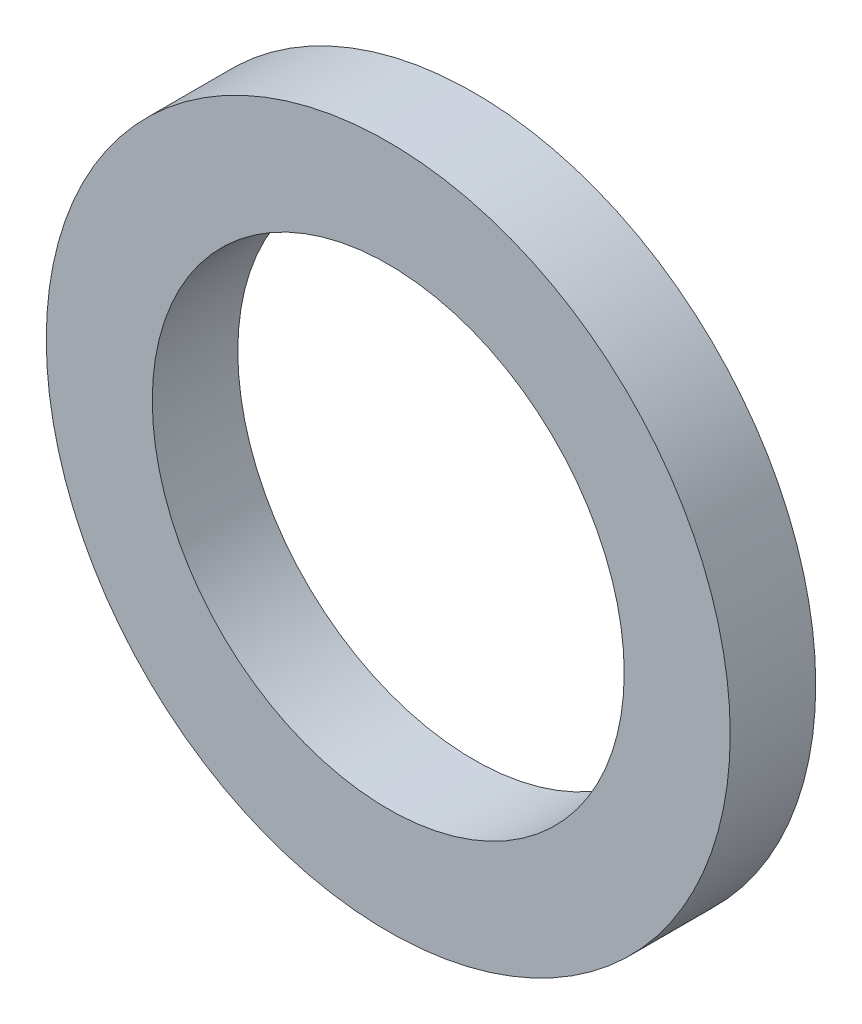
from build123d import *

# Parameters (mm, degrees)
SKETCH1_R           = 12.7
BOSS_EXTRUDE1_DEPTH = 3.175
SKETCH2_R           = 8.763
CUT_EXTRUDE1_DEPTH  = 3.175


with BuildPart() as part:
    # Sketch1 → Boss-Extrude1 (new body)
    with BuildSketch(Plane.XY):
        Circle(SKETCH1_R)
    extrude(amount=BOSS_EXTRUDE1_DEPTH)

    # Sketch2 → Cut-Extrude1 (cut)
    with BuildSketch(Plane.XY.offset(3.175)):
        Circle(SKETCH2_R)
    extrude(amount=-CUT_EXTRUDE1_DEPTH, mode=Mode.SUBTRACT)


solid = part.part
